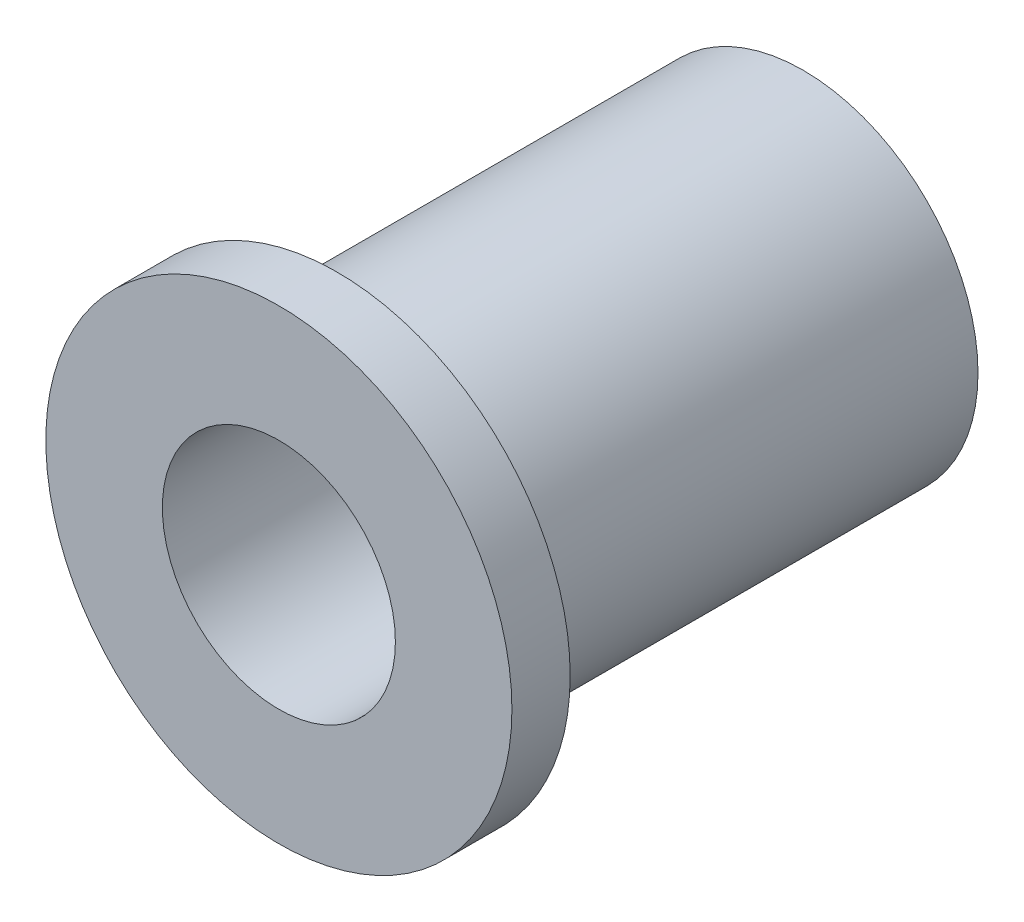
from build123d import *

# Parameters (mm, degrees)
SKETCH1_R           = 9.525
SKETCH1_R_2         = 6.35
BOSS_EXTRUDE1_DEPTH = 12.7
SKETCH2_R           = 12.7
SKETCH2_R_2         = 6.35
BOSS_EXTRUDE2_DEPTH = 3.175


with BuildPart() as part:
    # Sketch1 → Boss-Extrude1 (new, symmetric)
    with BuildSketch(Plane.XY):
        Circle(SKETCH1_R)
        Circle(SKETCH1_R_2, mode=Mode.SUBTRACT)
    extrude(amount=BOSS_EXTRUDE1_DEPTH, both=True)

    # Sketch2 → Boss-Extrude2 (add)
    with BuildSketch(Plane.XY.offset(12.7)):
        Circle(SKETCH2_R)
        Circle(SKETCH2_R_2, mode=Mode.SUBTRACT)
    extrude(amount=BOSS_EXTRUDE2_DEPTH)


solid = part.part
